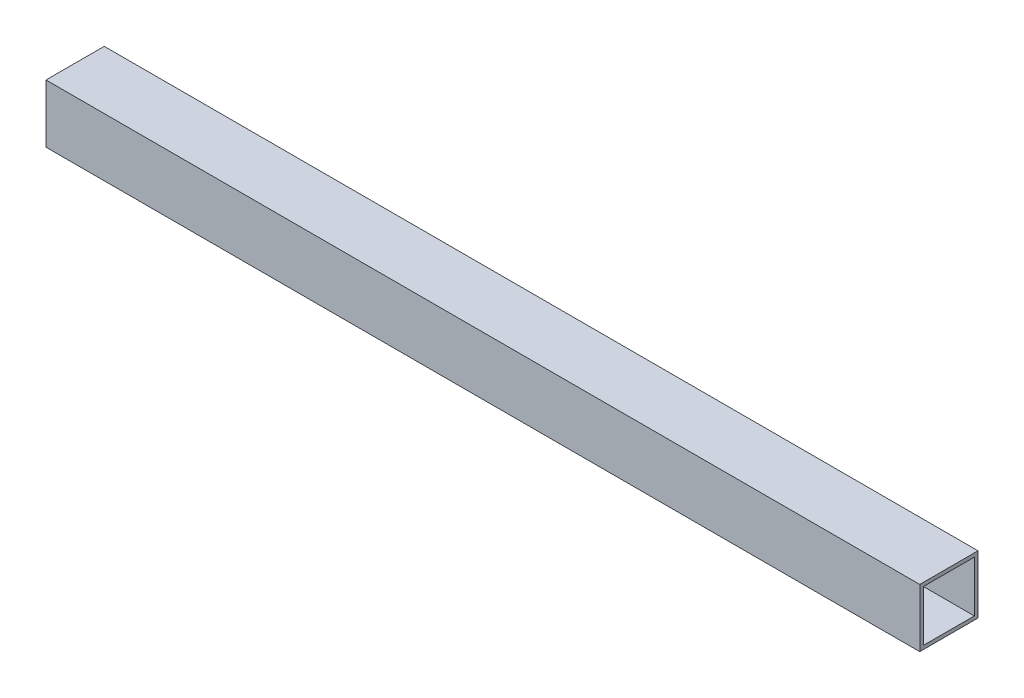
from build123d import *

# Parameters (mm, degrees)
SKETCH1_W           = 25.4
SKETCH1_H           = 25.4
SKETCH1_W_2         = 22.225
SKETCH1_H_2         = 22.225
EXTRUDE_THIN1_DEPTH = 381


with BuildPart() as part:
    # Sketch1 → Extrude-Thin1 (new body)
    with BuildSketch(Plane(origin=(0, 0, 0), x_dir=(0, 0, -1), z_dir=(1, 0, 0))):
        Rectangle(SKETCH1_W, SKETCH1_H)
        Rectangle(SKETCH1_W_2, SKETCH1_H_2, mode=Mode.SUBTRACT)
    extrude(amount=EXTRUDE_THIN1_DEPTH)


solid = part.part
